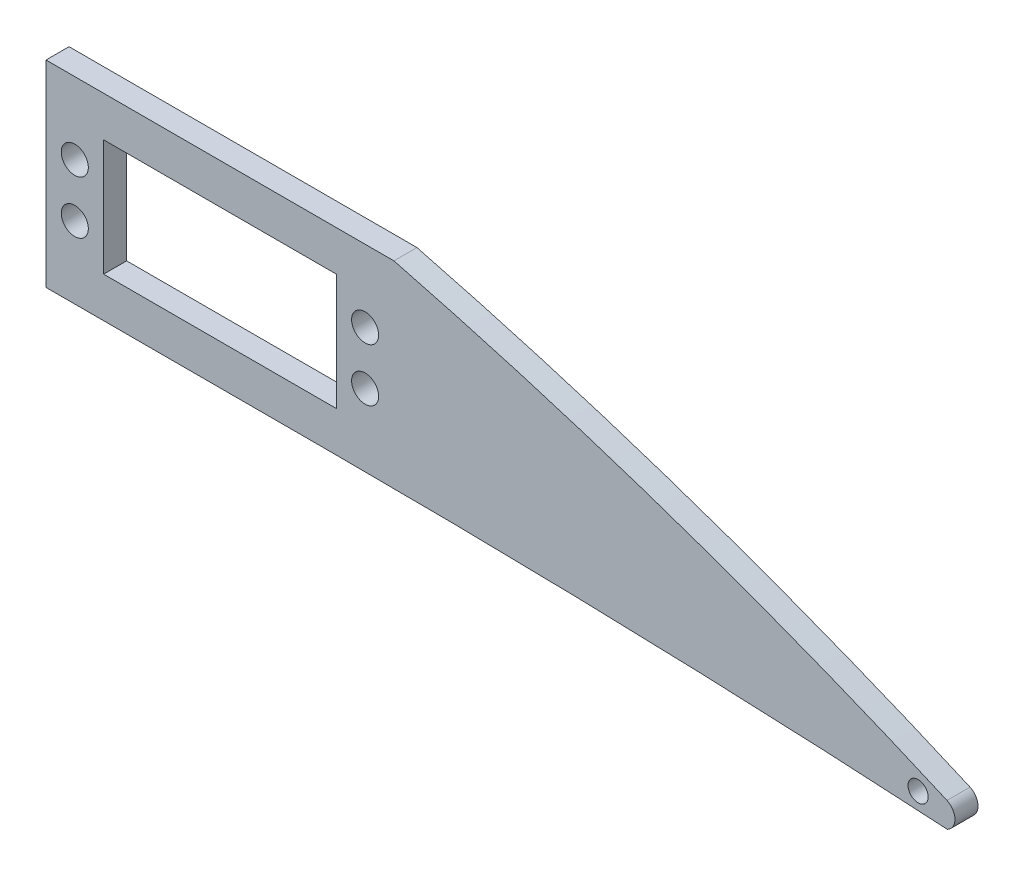
from build123d import *

# Parameters (mm, degrees)
SZKIC2_R                    = 2.35
SZKIC2_R_2                  = 1.75
SZKIC2_W                    = 40.4
SZKIC2_H                    = 20.2
DODANIE_WYCI_GNI_CIE1_DEPTH = 4


with BuildPart() as part:
    # Szkic2 → Dodanie-wyciągnięcie1 (new body)
    with BuildSketch(Plane.XY):
        with BuildLine():
            Line((-30.2, 17.1), (30.2, 17.1))
            ThreePointArc((30.2, 17.1), (78.887653554, 2.515256091), (126.216652739, -16.009543491))
            ThreePointArc((126.216652739, -16.009543491), (127.600370297, -18.154974458), (126.269263581, -20.333437957))
            ThreePointArc((126.269263581, -20.333437957), (72.757727431, -17.908543704), (19.197379501, -17.1))
            Line((19.197379501, -17.1), (-30.2, -17.1))
            Line((-30.2, -17.1), (-30.2, 17.1))
        make_face()
        with Locations((-25.2, 4.6)):
            Circle(SZKIC2_R, mode=Mode.SUBTRACT)
        with Locations(Location((25.2, 4.6, 0), (0, 0, 180))):
            Circle(SZKIC2_R, mode=Mode.SUBTRACT)
        with Locations((25.2, -4.6)):
            Circle(SZKIC2_R, mode=Mode.SUBTRACT)
        with Locations(Location((-25.2, -4.6, 0), (0, 0, 180))):
            Circle(SZKIC2_R, mode=Mode.SUBTRACT)
        with Locations((121.2, -17.133437957)):
            Circle(SZKIC2_R_2, mode=Mode.SUBTRACT)
        Rectangle(SZKIC2_W, SZKIC2_H, mode=Mode.SUBTRACT)
    extrude(amount=DODANIE_WYCI_GNI_CIE1_DEPTH)


solid = part.part
